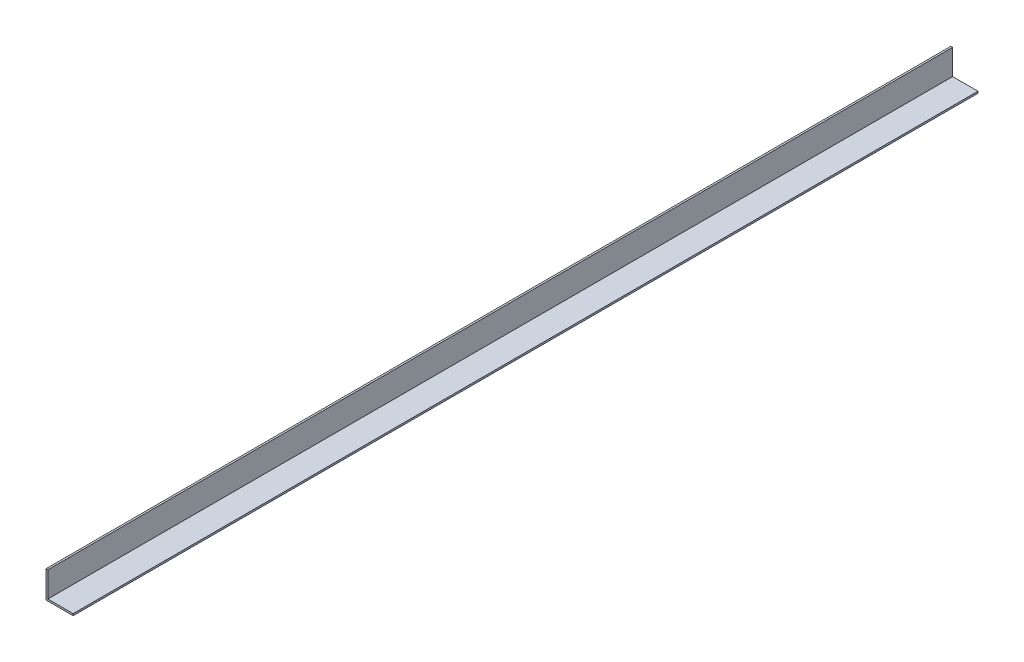
from build123d import *

# Parameters (mm, degrees)
BOSS_EXTRUDE1_DEPTH = 1000


with BuildPart() as part:
    # Sketch1 → Boss-Extrude1 (new body)
    with BuildSketch(Plane.XY):
        Polygon((0, 0), (-30, 0), (-30, 30), (-28, 30), (-28, 28), (-28, 2), (0, 2), align=None)
    extrude(amount=BOSS_EXTRUDE1_DEPTH)


solid = part.part
